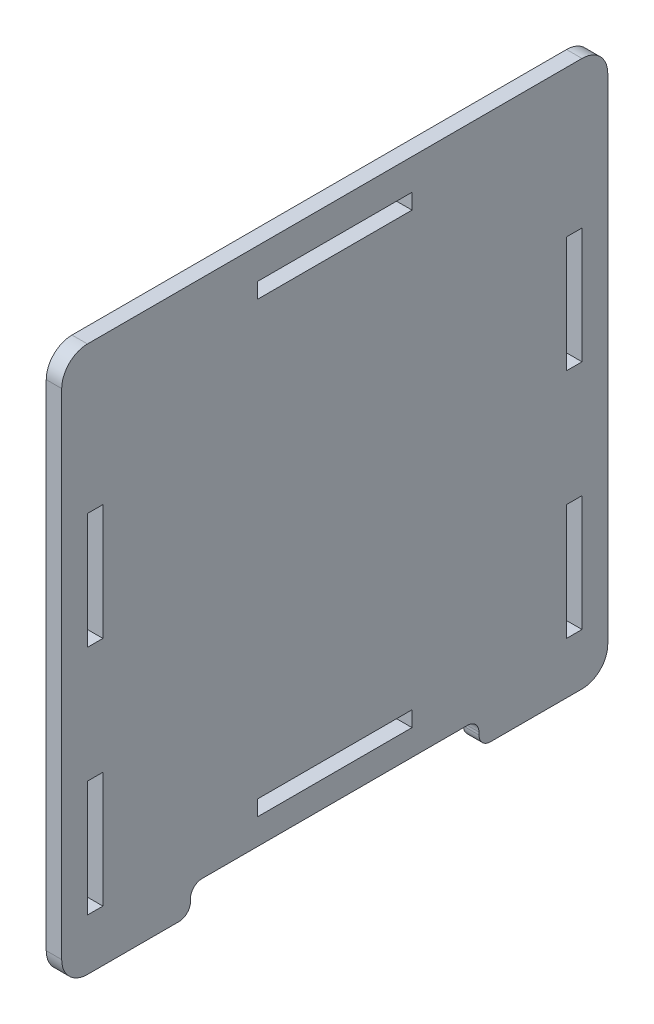
from build123d import *

# Parameters (mm, degrees)
SKETCH1_W           = 30
SKETCH1_H           = 3
SKETCH1_W_2         = 3
SKETCH1_H_2         = 22.5
BOSS_EXTRUDE1_DEPTH = 3


with BuildPart() as part:
    # Sketch1 → Boss-Extrude1 (new body)
    with BuildSketch(Plane(origin=(0, 0, 0), x_dir=(0, 0, -1), z_dir=(1, 0, 0))):
        with BuildLine():
            Line((75.25, -13), (93, -13))
            ThreePointArc((93, -13), (96.535533906, -11.535533906), (98, -8))
            Line((98, -8), (98, 88))
            ThreePointArc((98, 88), (96.535533906, 91.535533906), (93, 93))
            Line((93, 93), (-3, 93))
            ThreePointArc((-3, 93), (-6.535533906, 91.535533906), (-8, 88))
            Line((-8, 88), (-8, -8))
            ThreePointArc((-8, -8), (-6.535533906, -11.535533906), (-3, -13))
            Line((-3, -13), (14.75, -13))
            ThreePointArc((14.75, -13), (16.340990258, -12.340990258), (17, -10.75))
            Line((17, -10.75), (17, -10.25))
            ThreePointArc((17, -10.25), (17.659009742, -8.659009742), (19.25, -8))
            Line((19.25, -8), (70.75, -8))
            ThreePointArc((70.75, -8), (72.340990258, -8.659009742), (73, -10.25))
            Line((73, -10.25), (73, -10.75))
            ThreePointArc((73, -10.75), (73.659009742, -12.340990258), (75.25, -13))
        make_face()
        Polygon((0, 0), (0, 19.5), (-3, 19.5), (-3, -3), (0, -3), align=None, mode=Mode.SUBTRACT)
        Polygon((90, 0), (90, 19.5), (93, 19.5), (93, -3), (90, -3), align=None, mode=Mode.SUBTRACT)
        with Locations((45, 85.5)):
            Rectangle(SKETCH1_W, SKETCH1_H, mode=Mode.SUBTRACT)
        with Locations((45, -1.5)):
            Rectangle(SKETCH1_W, SKETCH1_H, mode=Mode.SUBTRACT)
        with Locations((91.5, 53.25)):
            Rectangle(SKETCH1_W_2, SKETCH1_H_2, mode=Mode.SUBTRACT)
        with Locations((-1.5, 53.25)):
            Rectangle(SKETCH1_W_2, SKETCH1_H_2, mode=Mode.SUBTRACT)
    extrude(amount=BOSS_EXTRUDE1_DEPTH)


solid = part.part
